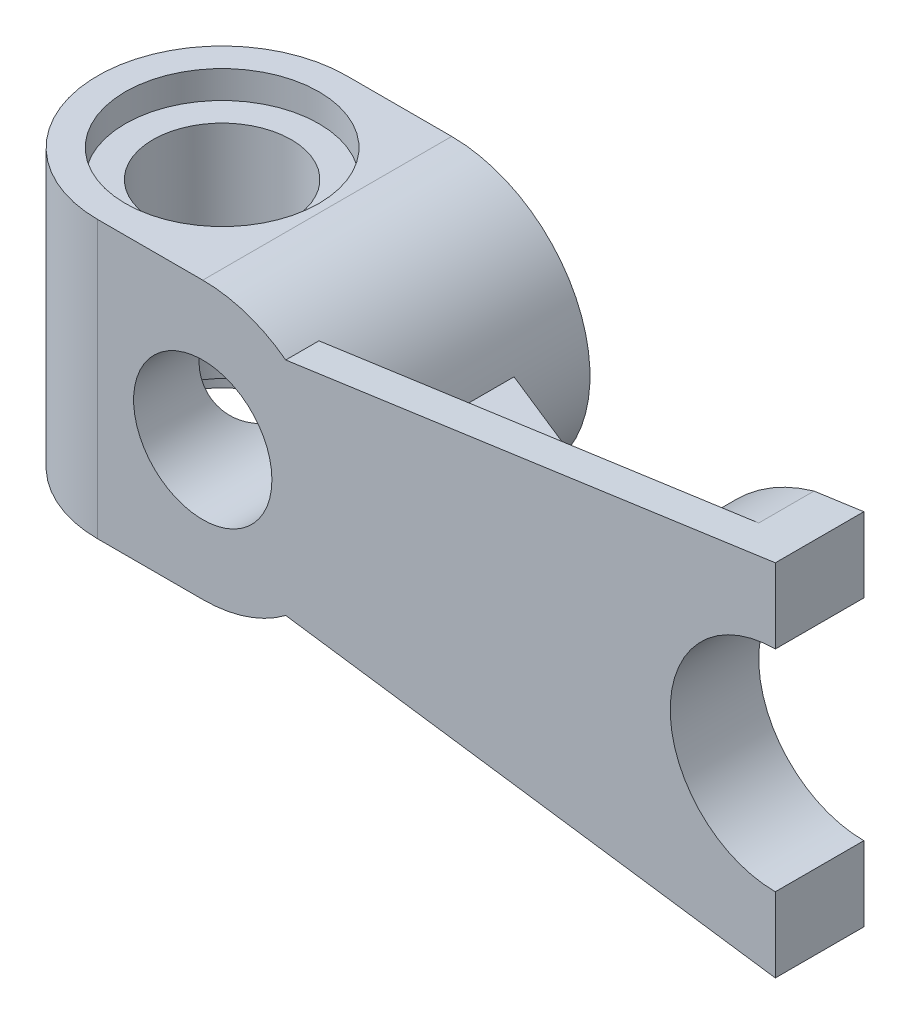
from build123d import *

# Parameters (mm, degrees)
SKETCH1_R           = 12.5
BOSS_EXTRUDE1_DEPTH = 45
BOSS_EXTRUDE2_DEPTH = 50
SKETCH4_R           = 17.5
CUT_EXTRUDE1_DEPTH  = 5
CUT_EXTRUDE2_START  = -5
SKETCH5_R           = 17.5
CUT_EXTRUDE2_DEPTH  = 5
SKETCH6_R           = 12.5
CUT_EXTRUDE3_DEPTH  = 96
BOSS_EXTRUDE3_DEPTH = 16
BOSS_EXTRUDE4_START = -6
BOSS_EXTRUDE4_DEPTH = 6
BOSS_EXTRUDE5_DEPTH = 26
CUT_EXTRUDE6_DEPTH  = 27
CUT_EXTRUDE13_DEPTH = 45
CUT_EXTRUDE14_DEPTH = 45


with BuildPart() as part:
    # Sketch1 → Boss-Extrude1 (new body)
    with BuildSketch(Plane.XY):
        with BuildLine():
            Line((-16.9285558, 31.718520583), (-35.9285558, 31.718520583))
            Line((-35.9285558, 31.718520583), (-35.9285558, -18.281479417))
            Line((-35.9285558, -18.281479417), (-16.9285558, -18.281479417))
            ThreePointArc((-16.9285558, -18.281479417), (8.0714442, 6.718520583), (-16.9285558, 31.718520583))
        make_face()
        with Locations(Location((-16.9285558, 6.718520583, 0), (0, 0, 180))):
            Circle(SKETCH1_R, mode=Mode.SUBTRACT)
    extrude(amount=BOSS_EXTRUDE1_DEPTH)

    # Sketch2 → Boss-Extrude2 (add)
    with BuildSketch(Plane(origin=(0, 31.718520583, 0), x_dir=(1, 0, 0), z_dir=(0, 1, 0))):
        with BuildLine():
            Line((-35.9285558, 0), (-35.9285558, -45))
            ThreePointArc((-35.9285558, -45), (-58.4285558, -22.5), (-35.9285558, 0))
        make_face()
    extrude(amount=-BOSS_EXTRUDE2_DEPTH)

    # Sketch4 → Cut-Extrude1 (cut)
    with BuildSketch(Plane(origin=(0, 31.718520583, 0), x_dir=(1, 0, 0), z_dir=(0, 1, 0))):
        with Locations(Location((-35.9285558, -22.5, 0), (0, 0, 270))):
            Circle(SKETCH4_R)
    extrude(amount=-CUT_EXTRUDE1_DEPTH, mode=Mode.SUBTRACT)

    # Sketch5 → Cut-Extrude2 (cut)
    with BuildSketch(Plane.XZ.offset(18.281479417).offset(CUT_EXTRUDE2_START)):
        with Locations(Location((-35.9285558, 22.5, 0), (0, 0, 90))):
            Circle(SKETCH5_R)
    extrude(amount=CUT_EXTRUDE2_DEPTH, mode=Mode.SUBTRACT)

    # Sketch6 → Cut-Extrude3 (cut)
    with BuildSketch(Plane.XZ.offset(13.281479417)):
        with Locations(Location((-35.9285558, 22.5, 0), (0, 0, 270))):
            Circle(SKETCH6_R)
    extrude(amount=-CUT_EXTRUDE3_DEPTH, mode=Mode.SUBTRACT)



with BuildPart() as body_2:
    # Sketch7 → Boss-Extrude3 (new body)
    with BuildSketch(Plane.XY.offset(45)):
        with BuildLine():
            Line((86.5714442, 39.218520583), (86.5714442, 25.718520583))
            ThreePointArc((86.5714442, 25.718520583), (67.5714442, 6.718520583), (86.5714442, -12.281479417))
            Line((86.5714442, -12.281479417), (86.5714442, -25.781479417))
            ThreePointArc((86.5714442, -25.781479417), (54.0714442, 6.718520583), (86.5714442, 39.218520583))
        make_face()
    extrude(amount=-BOSS_EXTRUDE3_DEPTH)


with BuildPart() as part_1:
    add(part.part)

    add(body_2.part)  # Boss-Extrude4 merges body 2
    # Sketch8 → Boss-Extrude4 (add)
    with BuildSketch(Plane.XY.offset(45).offset(BOSS_EXTRUDE4_START)):
        with BuildLine():
            Line((77.570223695, 37.947161755), (-1.9285558, 26.718520583))
            ThreePointArc((-1.9285558, 26.718520583), (8.0714442, 6.718520583), (-1.9285558, -13.281479417))
            Line((-1.9285558, -13.281479417), (77.570223695, -24.510120588))
            ThreePointArc((77.570223695, -24.510120588), (54.0714442, 6.718520583), (77.570223695, 37.947161755))
        make_face()
    extrude(amount=BOSS_EXTRUDE4_DEPTH)

    # Sketch11 → Boss-Extrude5 (add)
    with BuildSketch(Plane(origin=(0, 0, 39), x_dir=(-1, 0, 0), z_dir=(0, 0, -1))):
        with BuildLine():
            Line((-7.340766399, 12.718520583), (-54.630091692, 12.718520583))
            ThreePointArc((-54.630091692, 12.718520583), (-54.0714442, 6.718520583), (-54.630091692, 0.718520583))
            Line((-54.630091692, 0.718520583), (-7.340766399, 0.718520583))
            ThreePointArc((-7.340766399, 0.718520583), (-8.0714442, 6.718520583), (-7.340766399, 12.718520583))
        make_face()
    extrude(amount=BOSS_EXTRUDE5_DEPTH)

    # Sketch12 → Cut-Extrude6 (cut)
    with BuildSketch(Plane.XZ.offset(-0.718520583)):
        Polygon((54.630091692, 32), (7.340766399, 13), (54.630091692, 13), align=None)
    extrude(amount=-CUT_EXTRUDE6_DEPTH, mode=Mode.SUBTRACT)

    # Sketch22 → Cut-Extrude13 (cut)
    with BuildSketch(Plane.XY.offset(45)):
        Polygon((86.5714442, 39.218520583), (77.570223695, 37.947161755), (65.199967012, 56.955266835), (110.383312753, 52.793642885), align=None)
    extrude(amount=-CUT_EXTRUDE13_DEPTH, mode=Mode.SUBTRACT)

    # Sketch23 → Cut-Extrude14 (cut)
    with BuildSketch(Plane.XY.offset(45)):
        Polygon((86.5714442, -25.781479417), (77.570223695, -24.510120588), (41.145903609, -43.152647533), (115.929494314, -52.929136625), align=None)
    extrude(amount=-CUT_EXTRUDE14_DEPTH, mode=Mode.SUBTRACT)


solid = part_1.part
